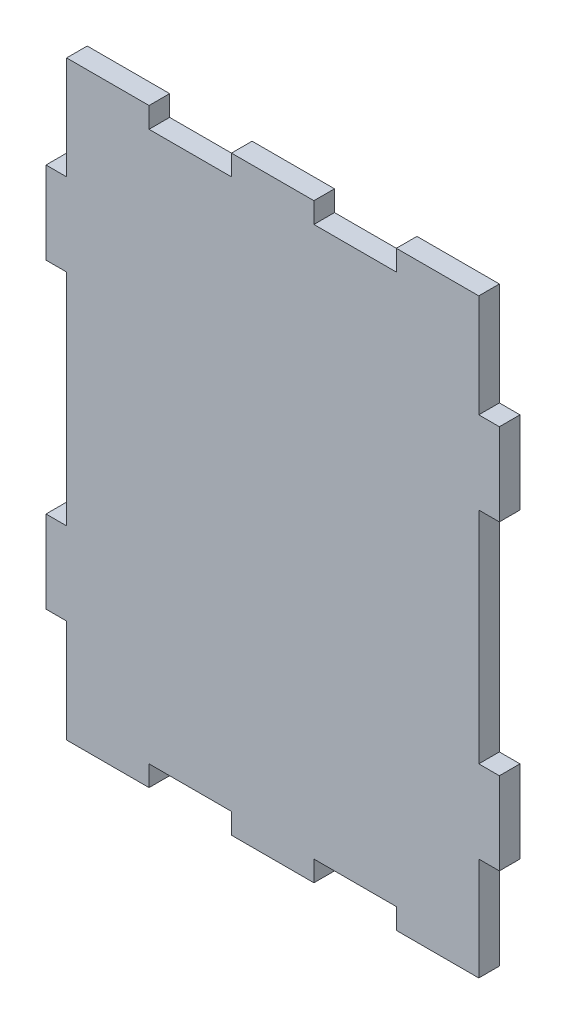
from build123d import *

# Parameters (mm, degrees)
RESSALTO_EXTRUS_O1_DEPTH = 3


with BuildPart() as part:
    # Esboço1 → Ressalto-extrusão1 (new body)
    with BuildSketch(Plane.XY):
        Polygon((-31.216896784, 9.348259862), (-31.216896784, -22.651740138), (-34.216896784, -22.651740138), (-34.216896784, -34.651740138), (-31.216896784, -34.651740138), (-31.216896784, -46.651740138), (-31.216896784, -49.651740138), (-19.216896784, -49.651740138), (-19.216896784, -46.651740138), (-7.216896784, -46.651740138), (-7.216896784, -49.651740138), (4.783103216, -49.651740138), (4.783103216, -46.651740138), (16.783103216, -46.651740138), (16.783103216, -49.651740138), (28.783103216, -49.651740138), (28.783103216, -46.651740138), (28.783103216, -34.651740138), (31.783103216, -34.651740138), (31.783103216, -22.651740138), (28.783103216, -22.651740138), (28.783103216, 9.348259862), (31.783103216, 9.348259862), (31.783103216, 21.348259862), (28.783103216, 21.348259862), (28.783103216, 33.348259862), (28.783103216, 36.348259862), (16.783103216, 36.348259862), (16.783103216, 33.348259862), (4.783103216, 33.348259862), (4.783103216, 36.348259862), (-7.216896784, 36.348259862), (-7.216896784, 33.348259862), (-19.216896784, 33.348259862), (-19.216896784, 36.348259862), (-31.216896784, 36.348259862), (-31.216896784, 33.348259862), (-31.216896784, 21.348259862), (-34.216896784, 21.348259862), (-34.216896784, 9.348259862), align=None)
    extrude(amount=RESSALTO_EXTRUS_O1_DEPTH)


solid = part.part
